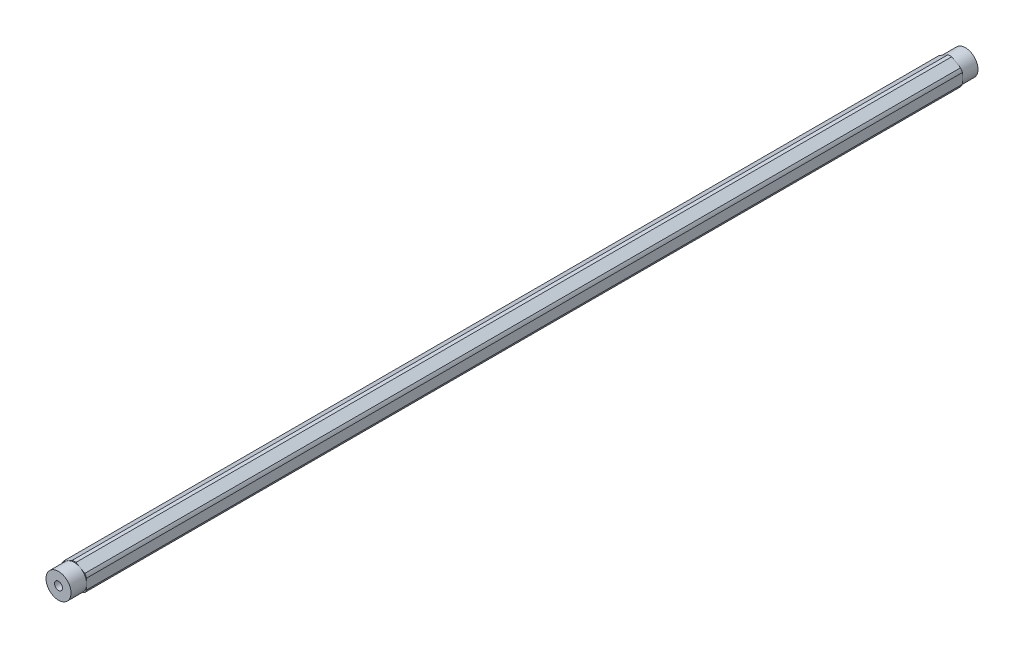
from build123d import *

# Parameters (mm, degrees)
BOSS_EXTRUDE1_DEPTH = 222.25
SKETCH5_R           = 6.35
BOSS_EXTRUDE2_DEPTH = 7.9375


with BuildPart() as part:
    # Sketch1 → Boss-Extrude1 (new, symmetric)
    with BuildSketch(Plane.XY):
        with BuildLine():
            ThreePointArc((0.93173274, 6.79441227), (0, 6.858), (-0.93173274, 6.79441227))
            Line((-0.93173274, 6.79441227), (-5.41826726, 4.204110358))
            ThreePointArc((-5.41826726, 4.204110358), (-5.939202219, 3.429), (-6.35, 2.590301913))
            Line((-6.35, 2.590301913), (-6.35, -2.590301913))
            ThreePointArc((-6.35, -2.590301913), (-5.939202219, -3.429), (-5.41826726, -4.204110358))
            Line((-5.41826726, -4.204110358), (-0.93173274, -6.79441227))
            ThreePointArc((-0.93173274, -6.79441227), (0, -6.858), (0.93173274, -6.79441227))
            Line((0.93173274, -6.79441227), (5.41826726, -4.204110358))
            ThreePointArc((5.41826726, -4.204110358), (5.939202219, -3.429), (6.35, -2.590301913))
            Line((6.35, -2.590301913), (6.35, 2.590301913))
            ThreePointArc((6.35, 2.590301913), (5.939202219, 3.429), (5.41826726, 4.204110358))
            Line((5.41826726, 4.204110358), (0.93173274, 6.79441227))
        make_face()
    extrude(amount=BOSS_EXTRUDE1_DEPTH, both=True)

    # Sketch5 → Boss-Extrude2 (add)
    with BuildSketch(Plane.XY.offset(222.25)):
        Circle(SKETCH5_R)
    boss_extrude2 = extrude(amount=BOSS_EXTRUDE2_DEPTH)

    # Sketch6 → #10-32 Tapped Hole2 (revolve, cut)
    with BuildSketch(Plane(origin=(0, 0, 230.1875), x_dir=(0, -1, 0), z_dir=(1, 0, 0))):
        Polygon((0, 0), (0, 16.290757848), (2.0193, 15.07744), (2.0193, 0), align=None)
    f_10_32_tapped_hole2 = revolve(axis=Axis((0, 0, 236.5375), (0, 0, -1)), mode=Mode.SUBTRACT)

    # Mirror1: Boss-Extrude2, #10-32 Tapped Hole2 across plane
    add(boss_extrude2.mirror(Plane.XY))
    add(f_10_32_tapped_hole2.mirror(Plane.XY), mode=Mode.SUBTRACT)


solid = part.part
